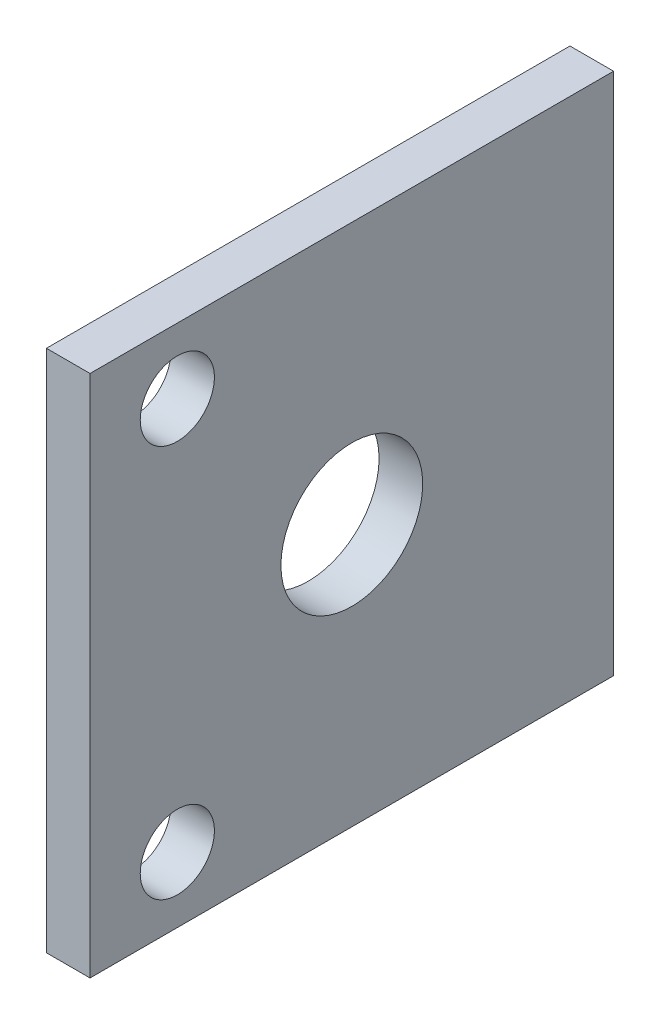
from build123d import *

# Parameters (mm, degrees)
THRUST_PLATE_BLANK_SKETCH_W      = 2
THRUST_PLATE_BLANK_SKETCH_H      = 24
THRUST_PLATE_BLANK_DEPTH         = 24
SCREW_RUNNING_CLEARANCE_SKETCH_R = 3.25
SCREW_RUNNING_CLEARANCE_DEPTH    = 2.2
M3_PLATE_CLEARANCE_1_SKETCH_R    = 1.7
M3_PLATE_CLEARANCE_1_DEPTH       = 2.2
M3_PLATE_CLEARANCE_2_SKETCH_R    = 1.7
M3_PLATE_CLEARANCE_2_DEPTH       = 2.2


with BuildPart() as part:
    # Thrust plate blank sketch → Thrust plate blank (new body)
    with BuildSketch(Plane.XY.offset(-31.5)):
        with Locations((14, -29)):
            Rectangle(THRUST_PLATE_BLANK_SKETCH_W, THRUST_PLATE_BLANK_SKETCH_H)
    extrude(amount=THRUST_PLATE_BLANK_DEPTH)

    # Screw running clearance sketch → Screw running clearance (cut)
    with BuildSketch(Plane(origin=(12.9, 0, 0), x_dir=(0, 0, -1), z_dir=(1, 0, 0))):
        with Locations(Location((19.5, -29, 0), (0, 0, 180))):
            Circle(SCREW_RUNNING_CLEARANCE_SKETCH_R)
    extrude(amount=SCREW_RUNNING_CLEARANCE_DEPTH, mode=Mode.SUBTRACT)

    # M3 plate clearance 1 sketch → M3 plate clearance 1 (cut)
    with BuildSketch(Plane(origin=(12.9, 0, 0), x_dir=(0, 0, -1), z_dir=(1, 0, 0))):
        with Locations(Location((11.5, -38, 0), (0, 0, 180))):
            Circle(M3_PLATE_CLEARANCE_1_SKETCH_R)
    extrude(amount=M3_PLATE_CLEARANCE_1_DEPTH, mode=Mode.SUBTRACT)

    # M3 plate clearance 2 sketch → M3 plate clearance 2 (cut)
    with BuildSketch(Plane(origin=(12.9, 0, 0), x_dir=(0, 0, -1), z_dir=(1, 0, 0))):
        with Locations(Location((11.5, -20, 0), (0, 0, 180))):
            Circle(M3_PLATE_CLEARANCE_2_SKETCH_R)
    extrude(amount=M3_PLATE_CLEARANCE_2_DEPTH, mode=Mode.SUBTRACT)


solid = part.part
